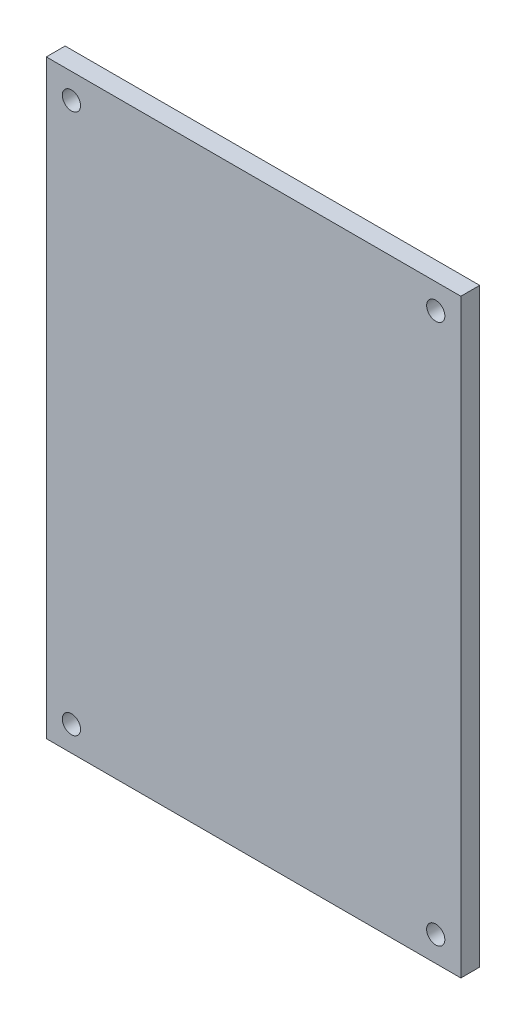
from build123d import *

# Parameters (mm, degrees)
SKETCH1_W           = 66
SKETCH1_H           = 94
SKETCH1_R           = 1.45
BOSS_EXTRUDE1_DEPTH = 3


with BuildPart() as part:
    # Sketch1 → Boss-Extrude1 (new body)
    with BuildSketch(Plane.XY):
        with Locations((0, 1.265176442)):
            Rectangle(SKETCH1_W, SKETCH1_H)
        with Locations((29, -41.734823558)):
            Circle(SKETCH1_R, mode=Mode.SUBTRACT)
        with Locations((29, 44.265176442)):
            Circle(SKETCH1_R, mode=Mode.SUBTRACT)
        with Locations((-29, -41.734823558)):
            Circle(SKETCH1_R, mode=Mode.SUBTRACT)
        with Locations((-29, 44.265176442)):
            Circle(SKETCH1_R, mode=Mode.SUBTRACT)
    extrude(amount=BOSS_EXTRUDE1_DEPTH)


solid = part.part
